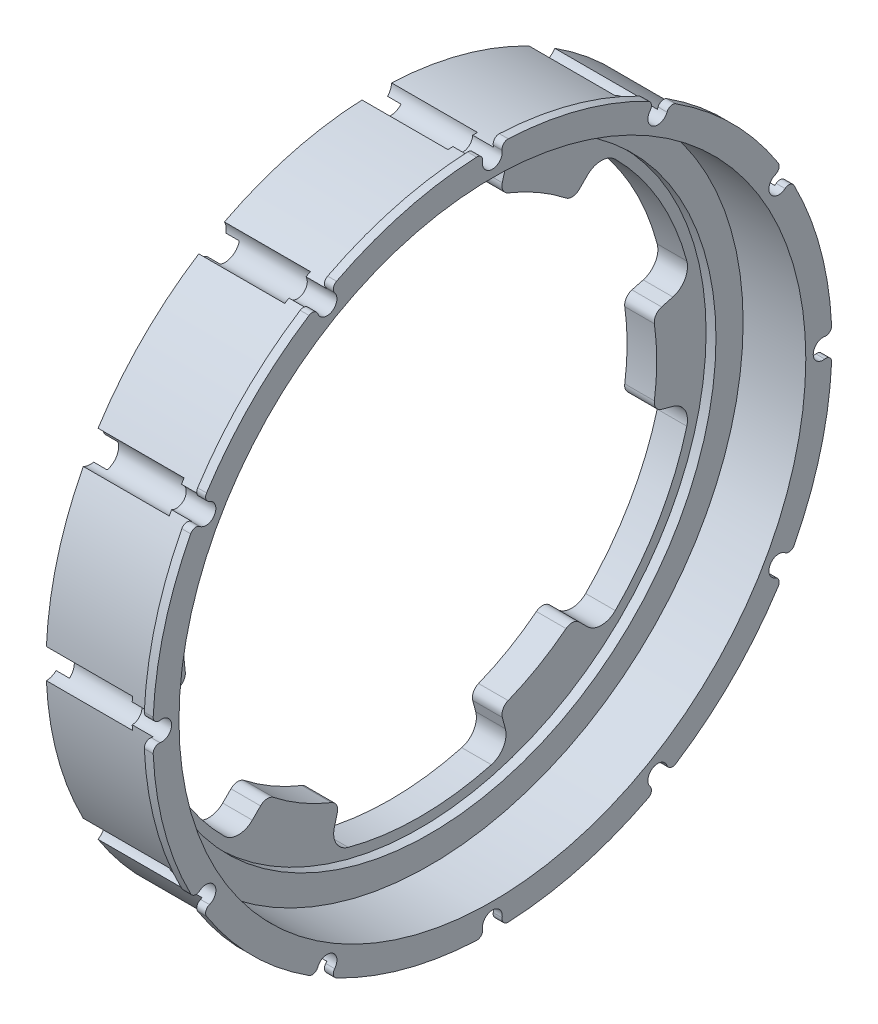
from build123d import *

# Parameters (mm, degrees)
CUT_EXTRUDE1_START       = -10
CUT_EXTRUDE1_DEPTH       = 10
FILLET1_R                = 1
CIRPATTERN2_COUNT        = 6
CIRPATTERN2_START        = -10
CIRPATTERN2_COPY_1_DEPTH = 10
CIRPATTERN2_COPY_2_DEPTH = 10
CIRPATTERN2_COPY_3_DEPTH = 10
CIRPATTERN2_COPY_4_DEPTH = 10
CIRPATTERN2_COPY_5_DEPTH = 10
FILLET1_OF_CIRPATTERN2_R = 1
SKETCH5_R                = 34.4
SKETCH5_R_2              = 33.5
BOSS_EXTRUDE1_DEPTH      = 0.9
CUT_EXTRUDE2_START       = -3
SKETCH3_R                = 1.5
CUT_EXTRUDE2_DEPTH       = 48.039011344
SKETCH4_R                = 1
CUT_EXTRUDE3_DEPTH       = 10
FILLET2_R                = 0.6
CIRPATTERN3_COUNT        = 12
FILLET2_OF_CIRPATTERN3_R = 0.6


with BuildPart() as part:
    # Sketch1 → Revolve1 (revolve)
    with BuildSketch(Plane.XY, mode=Mode.PRIVATE) as revolve1_sk:
        Polygon((0, 24), (0, 32.5), (-1.3625, 32.5), (-1.3625, 33.5), (0, 33.5), (10.35, 33.5), (10.35, 31.75), (4, 31.75), (4, 29), (3, 29), (3, 24), align=None)
    revolve(revolve1_sk.sketch.rotate(Axis((0, 0, 0), (1, 0, 0)), 90), axis=Axis((0, 0, 0), (1, 0, 0)))

    # Sketch2 → Cut-Extrude1 (cut)
    with BuildSketch(Plane(origin=(3, 0, 0), x_dir=(0, 0, -1), z_dir=(1, 0, 0)).offset(CUT_EXTRUDE1_START)):
        with BuildLine():
            Line((8.661146825, 24.596433393), (8.121902906, 22.583947688))
            ThreePointArc((8.121902906, 22.583947688), (4.122211511, 23.643336741), (0, 24))
            Line((0, 24), (0, 28))
            ThreePointArc((0, 28), (3.654733382, 27.760456118), (7.246933263, 27.045923136))
            ThreePointArc((7.246933263, 27.045923136), (8.46134598, 26.114071484), (8.661146825, 24.596433393))
        make_face()
    cut_extrude1 = extrude(amount=CUT_EXTRUDE1_DEPTH, mode=Mode.SUBTRACT)

    # Mirror1: Cut-Extrude1 across plane
    add(cut_extrude1.mirror(Plane(origin=(-7, 28, 0), x_dir=(1, 0, 0), z_dir=(0, 0, 1))), mode=Mode.SUBTRACT)

    # Fillet1
    fillet1_edges = [part.edges().sort_by_distance(p)[0] for p in [
        (1.5, 22.583947688, -8.121902906),
        (1.5, 22.583947688, 8.121902906),
    ]]
    fillet(fillet1_edges, radius=FILLET1_R)

    # CirPattern2: Cut-Extrude1 ×6 about axis
    cirpattern2_axis = Axis((0, 0, 0), (1, 0, 0))
    for i in range(1, CIRPATTERN2_COUNT):
        add(cut_extrude1.rotate(cirpattern2_axis, i * 360 / CIRPATTERN2_COUNT), mode=Mode.SUBTRACT)

    # CirPattern2 copy 1 sketch → CirPattern2 copy 1 (cut)
    with BuildSketch(Plane(origin=(3, 0, 0), x_dir=(0, -0.8660254037844386, 0.5000000000000001), z_dir=(1, 0, 0)).offset(CIRPATTERN2_START)):
        with BuildLine():
            Line((8.661146825, -24.596433393), (8.121902906, -22.583947688))
            ThreePointArc((8.121902906, -22.583947688), (4.122211511, -23.643336741), (0, -24))
            Line((0, -24), (0, -28))
            ThreePointArc((0, -28), (3.654733382, -27.760456118), (7.246933263, -27.045923136))
            ThreePointArc((7.246933263, -27.045923136), (8.46134598, -26.114071484), (8.661146825, -24.596433393))
        make_face()
    extrude(amount=CIRPATTERN2_COPY_1_DEPTH, mode=Mode.SUBTRACT)

    # CirPattern2 copy 2 sketch → CirPattern2 copy 2 (cut)
    with BuildSketch(Plane(origin=(3, 0, 0), x_dir=(0, -0.8660254037844387, -0.4999999999999998), z_dir=(1, 0, 0)).offset(CIRPATTERN2_START)):
        with BuildLine():
            Line((8.661146825, -24.596433393), (8.121902906, -22.583947688))
            ThreePointArc((8.121902906, -22.583947688), (4.122211511, -23.643336741), (0, -24))
            Line((0, -24), (0, -28))
            ThreePointArc((0, -28), (3.654733382, -27.760456118), (7.246933263, -27.045923136))
            ThreePointArc((7.246933263, -27.045923136), (8.46134598, -26.114071484), (8.661146825, -24.596433393))
        make_face()
    extrude(amount=CIRPATTERN2_COPY_2_DEPTH, mode=Mode.SUBTRACT)

    # CirPattern2 copy 3 sketch → CirPattern2 copy 3 (cut)
    with BuildSketch(Plane(origin=(3, 0, 0), x_dir=(0, 0, -1), z_dir=(1, 0, 0)).offset(CIRPATTERN2_START)):
        with BuildLine():
            Line((8.661146825, -24.596433393), (8.121902906, -22.583947688))
            ThreePointArc((8.121902906, -22.583947688), (4.122211511, -23.643336741), (0, -24))
            Line((0, -24), (0, -28))
            ThreePointArc((0, -28), (3.654733382, -27.760456118), (7.246933263, -27.045923136))
            ThreePointArc((7.246933263, -27.045923136), (8.46134598, -26.114071484), (8.661146825, -24.596433393))
        make_face()
    extrude(amount=CIRPATTERN2_COPY_3_DEPTH, mode=Mode.SUBTRACT)

    # CirPattern2 copy 4 sketch → CirPattern2 copy 4 (cut)
    with BuildSketch(Plane(origin=(3, 0, 0), x_dir=(0, 0.8660254037844384, -0.5000000000000004), z_dir=(1, 0, 0)).offset(CIRPATTERN2_START)):
        with BuildLine():
            Line((8.661146825, -24.596433393), (8.121902906, -22.583947688))
            ThreePointArc((8.121902906, -22.583947688), (4.122211511, -23.643336741), (0, -24))
            Line((0, -24), (0, -28))
            ThreePointArc((0, -28), (3.654733382, -27.760456118), (7.246933263, -27.045923136))
            ThreePointArc((7.246933263, -27.045923136), (8.46134598, -26.114071484), (8.661146825, -24.596433393))
        make_face()
    extrude(amount=CIRPATTERN2_COPY_4_DEPTH, mode=Mode.SUBTRACT)

    # CirPattern2 copy 5 sketch → CirPattern2 copy 5 (cut)
    with BuildSketch(Plane(origin=(3, 0, 0), x_dir=(0, 0.8660254037844386, 0.5000000000000001), z_dir=(1, 0, 0)).offset(CIRPATTERN2_START)):
        with BuildLine():
            Line((8.661146825, -24.596433393), (8.121902906, -22.583947688))
            ThreePointArc((8.121902906, -22.583947688), (4.122211511, -23.643336741), (0, -24))
            Line((0, -24), (0, -28))
            ThreePointArc((0, -28), (3.654733382, -27.760456118), (7.246933263, -27.045923136))
            ThreePointArc((7.246933263, -27.045923136), (8.46134598, -26.114071484), (8.661146825, -24.596433393))
        make_face()
    extrude(amount=CIRPATTERN2_COPY_5_DEPTH, mode=Mode.SUBTRACT)

    # Fillet1 of CirPattern2
    fillet1_of_cirpattern2_edges = [part.edges().sort_by_distance(p)[0] for p in [
        (1.5, 18.325748088, 15.497320963),
        (1.5, 4.258199601, 23.619223869),
        (1.5, -4.258199601, 23.619223869),
        (1.5, -18.325748088, 15.497320963),
        (1.5, -22.583947688, 8.121902906),
        (1.5, -22.583947688, -8.121902906),
        (1.5, -18.325748088, -15.497320963),
        (1.5, -4.258199601, -23.619223869),
        (1.5, 4.258199601, -23.619223869),
        (1.5, 18.325748088, -15.497320963),
    ]]
    fillet(fillet1_of_cirpattern2_edges, radius=FILLET1_OF_CIRPATTERN2_R)

    # Sketch5 → Boss-Extrude1 (add)
    with BuildSketch(Plane(origin=(10.35, 0, 0), x_dir=(0, 0, -1), z_dir=(1, 0, 0))):
        Circle(SKETCH5_R)
        with Locations(Location((0, 0, 0), (0, 0, 180))):
            Circle(SKETCH5_R_2, mode=Mode.SUBTRACT)
    extrude(amount=-BOSS_EXTRUDE1_DEPTH)

    # Sketch3 → Cut-Extrude2 (cut, through all)
    with BuildSketch(Plane(origin=(10.35, 0, 0), x_dir=(0, 0, -1), z_dir=(1, 0, 0)).offset(CUT_EXTRUDE2_START)):
        with Locations((0, 33.5)):
            Circle(SKETCH3_R)
    cut_extrude2 = extrude(amount=-CUT_EXTRUDE2_DEPTH, mode=Mode.SUBTRACT)

    # Sketch4 → Cut-Extrude3 (cut)
    with BuildSketch(Plane.ZY.offset(-7.35)):
        with Locations((0, 33.5)):
            Circle(SKETCH4_R)
    cut_extrude3 = extrude(amount=-CUT_EXTRUDE3_DEPTH, mode=Mode.SUBTRACT)

    # Fillet2
    fillet2_edges = [part.edges().sort_by_distance(p)[0] for p in [
        (9.9, 34.397164179, 0.441697222),
        (9.9, 34.397164179, -0.441697222),
    ]]
    fillet(fillet2_edges, radius=FILLET2_R)

    # CirPattern3: Cut-Extrude2, Cut-Extrude3 ×12 about axis
    cirpattern3_axis = Axis((0, 0, 0), (1, 0, 0))
    add([cut_extrude2.rotate(cirpattern3_axis, i * 360 / CIRPATTERN3_COUNT) for i in range(1, CIRPATTERN3_COUNT)], mode=Mode.SUBTRACT)
    add([cut_extrude3.rotate(cirpattern3_axis, i * 360 / CIRPATTERN3_COUNT) for i in range(1, CIRPATTERN3_COUNT)], mode=Mode.SUBTRACT)

    # Fillet2 of CirPattern3
    fillet2_of_cirpattern3_edges = [part.edges().sort_by_distance(p)[0] for p in [
        (9.9, 29.567969386, 17.581103104),
        (9.9, 30.009666608, 16.816061075),
        (9.9, 16.816061075, 30.009666608),
        (9.9, 17.581103104, 29.567969386),
        (9.9, -0.441697222, 34.397164179),
        (9.9, 0.441697222, 34.397164179),
        (9.9, -17.581103104, 29.567969386),
        (9.9, -16.816061075, 30.009666608),
        (9.9, -30.009666608, 16.816061075),
        (9.9, -29.567969386, 17.581103104),
        (9.9, -34.397164179, -0.441697222),
        (9.9, -34.397164179, 0.441697222),
        (9.9, -29.567969386, -17.581103104),
        (9.9, -30.009666608, -16.816061075),
        (9.9, -16.816061075, -30.009666608),
        (9.9, -17.581103104, -29.567969386),
        (9.9, 0.441697222, -34.397164179),
        (9.9, -0.441697222, -34.397164179),
        (9.9, 17.581103104, -29.567969386),
        (9.9, 16.816061075, -30.009666608),
        (9.9, 30.009666608, -16.816061075),
        (9.9, 29.567969386, -17.581103104),
    ]]
    fillet(fillet2_of_cirpattern3_edges, radius=FILLET2_OF_CIRPATTERN3_R)


solid = part.part
